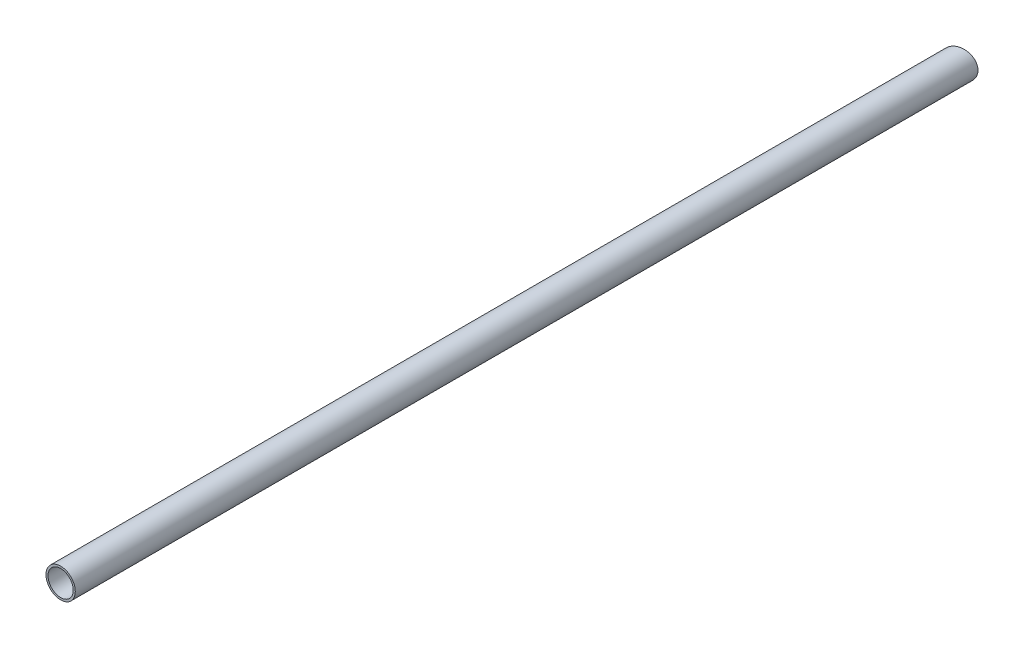
from build123d import *

# Parameters (mm, degrees)
SKETCH1_R               = 12.7
SKETCH1_R_2             = 10.922
BOSS_EXTRUDE1_DEPTH     = 782.32
CUT_EXTRUDE1_DEPTH      = 783.526141672
CUT_EXTRUDE1_DEPTH_BACK = 783.526141672


with BuildPart() as part:
    # Sketch1 → Boss-Extrude1 (new body)
    with BuildSketch(Plane.XY):
        Circle(SKETCH1_R)
        Circle(SKETCH1_R_2, mode=Mode.SUBTRACT)
    extrude(amount=BOSS_EXTRUDE1_DEPTH)

    # Sketch3 → Cut-Extrude1 (cut, two sides: drawn at the far end of the back side and taken through both)
    with BuildSketch(Plane(origin=(0, 0, 0), x_dir=(1, 0, 0), z_dir=(0, 1, 0)).offset(-CUT_EXTRUDE1_DEPTH_BACK)):
        Polygon((0, 0), (12.7, 0), (-50.8, -17.014773719), (-50.8, 0), align=None)
    extrude(amount=CUT_EXTRUDE1_DEPTH + CUT_EXTRUDE1_DEPTH_BACK, mode=Mode.SUBTRACT)


solid = part.part
